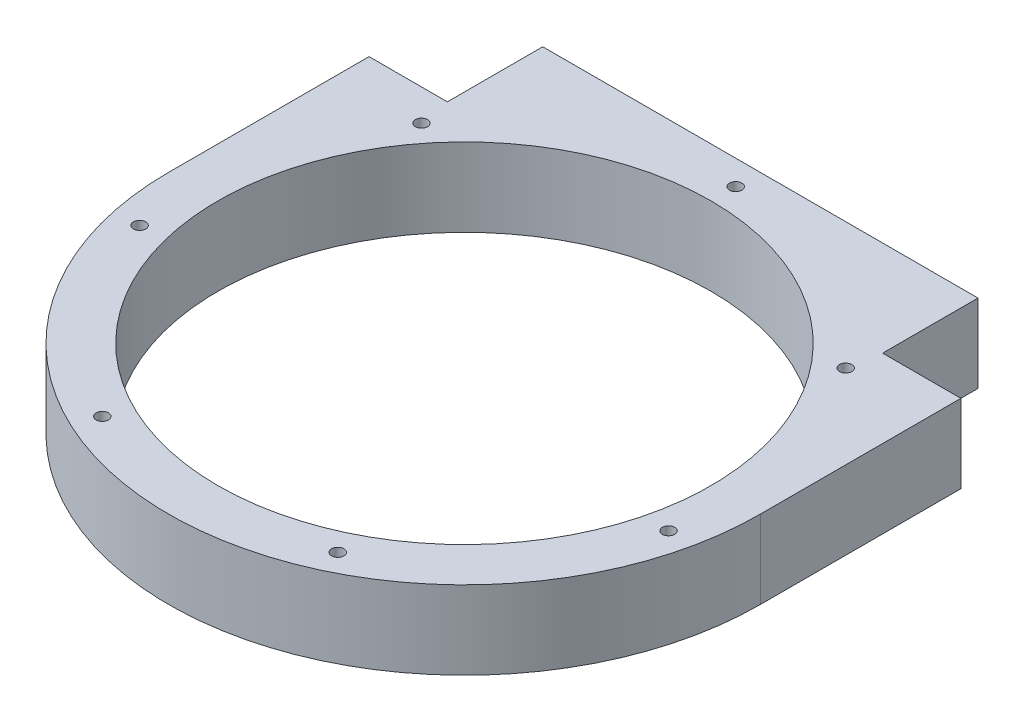
from build123d import *

# Parameters (mm, degrees)
SKETCH1_R           = 40
SKETCH1_R_2         = 1
BOSS_EXTRUDE1_DEPTH = 12.7


with BuildPart() as part:
    # Sketch1 → Boss-Extrude1 (new body)
    with BuildSketch(Plane(origin=(0, 0, 0), x_dir=(1, 0, 0), z_dir=(0, 1, 0))):
        with BuildLine():
            Line((-35.3, 48), (-35.3, 32.525528435))
            Line((-35.3, 32.525528435), (-48, 32.525528435))
            Line((-48, 32.525528435), (-48, 0))
            ThreePointArc((-48, 0), (0, -48), (48, 0))
            Line((48, 0), (48, 32.525528435))
            Line((48, 32.525528435), (35.3, 32.525528435))
            Line((35.3, 32.525528435), (35.3, 48))
            Line((35.3, 48), (-35.3, 48))
        make_face()
        Circle(SKETCH1_R, mode=Mode.SUBTRACT)
        with Locations((34.400585229, 27.433551282)):
            Circle(SKETCH1_R_2, mode=Mode.SUBTRACT)
        with Locations((-34.400585229, 27.433551282)):
            Circle(SKETCH1_R_2, mode=Mode.SUBTRACT)
        with Locations((0, 44)):
            Circle(SKETCH1_R_2, mode=Mode.SUBTRACT)
        with Locations((19.090884521, -39.642630188)):
            Circle(SKETCH1_R_2, mode=Mode.SUBTRACT)
        with Locations((42.896828136, -9.790921094)):
            Circle(SKETCH1_R_2, mode=Mode.SUBTRACT)
        with Locations((-19.090884521, -39.642630188)):
            Circle(SKETCH1_R_2, mode=Mode.SUBTRACT)
        with Locations((-42.896828136, -9.790921094)):
            Circle(SKETCH1_R_2, mode=Mode.SUBTRACT)
    extrude(amount=BOSS_EXTRUDE1_DEPTH)


solid = part.part
